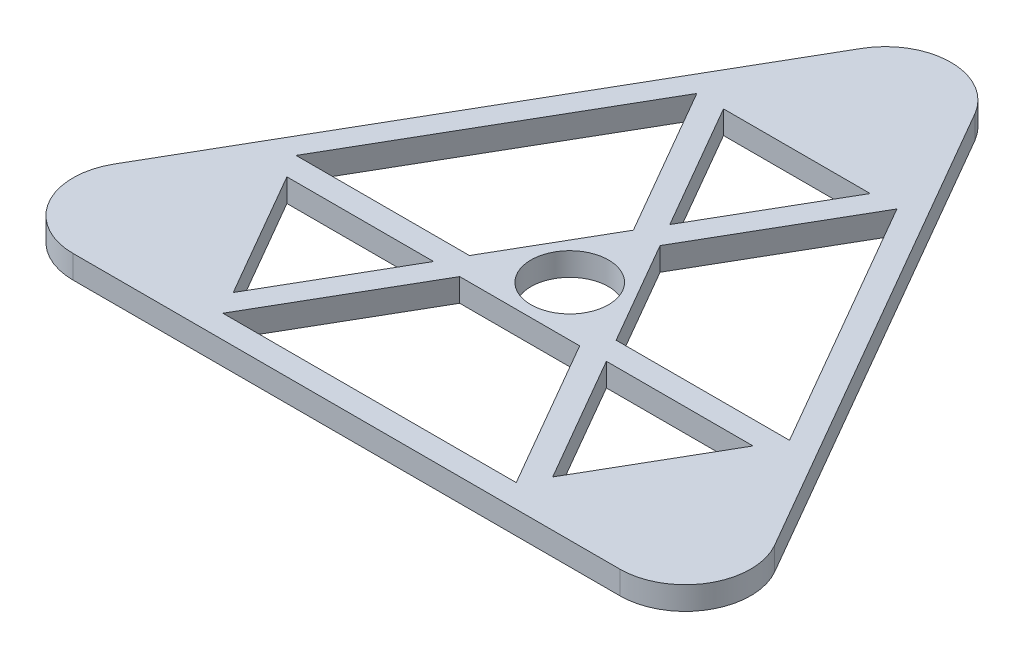
from build123d import *

# Parameters (mm, degrees)
EXTRUDE_17_DEPTH     = 2
SKETCH_4_R           = 3.35601343
CUT_EXTRUDE_25_DEPTH = 45.170960421


with BuildPart() as part:
    # 草图2 → 凸台-拉伸17 (new body)
    with BuildSketch(Plane(origin=(0, 0, 0), x_dir=(1, 0, 0), z_dir=(0, 1, 0))):
        with BuildLine():
            Line((-4.904700538, 30.145825623), (-28.559401011, -10.825317434))
            ThreePointArc((-28.559401011, -10.825317434), (-28.55940111, -16.488777843), (-23.654700538, -19.320508076))
            Line((-23.654700538, -19.320508076), (23.654700538, -19.320508076))
            ThreePointArc((23.654700538, -19.320508076), (28.559401192, -16.4887777), (28.559400847, -10.825317149))
            Line((28.559400847, -10.825317149), (4.904700538, 30.145825623))
            ThreePointArc((4.904700538, 30.145825623), (0, 32.977555799), (-4.904700538, 30.145825623))
        make_face()
        Polygon((-7.447524928, -4.330127019), (-13.79282439, -15.320508076), (-20.138123851, -4.330127019), align=None, mode=Mode.SUBTRACT)
        Polygon((5.190598923, -4.330127019), (12.690598923, -17.320508076), (-12.690598923, -17.320508076), (-5.190598923, -4.330127019), align=None, mode=Mode.SUBTRACT)
        Polygon((7.5, -4.330127019), (20.190598923, -4.330127019), (13.845299462, -15.320508076), align=None, mode=Mode.SUBTRACT)
        Polygon((-6.345299462, -2.330127019), (-21.345299462, -2.330127019), (-8.654700538, 19.650635095), (-1.154700538, 6.660254038), align=None, mode=Mode.SUBTRACT)
        Polygon((0, 8.660254038), (-6.345299462, 19.650635095), (6.345299462, 19.650635095), align=None, mode=Mode.SUBTRACT)
        Polygon((1.154700538, 6.660254038), (8.654700538, 19.650635095), (8.930688533, 19.172609866), (21.345299462, -2.330127019), (6.345299461, -2.330127019), align=None, mode=Mode.SUBTRACT)
    extrude(amount=EXTRUDE_17_DEPTH)

    # 草图4 → 切除-拉伸25 (cut, through all)
    with BuildSketch(Plane(origin=(0, 2, 0), x_dir=(1, 0, 0), z_dir=(0, 1, 0))):
        with Locations(Location((0, 0, 0), (0, 0, 270))):
            Circle(SKETCH_4_R)
    extrude(amount=-CUT_EXTRUDE_25_DEPTH, mode=Mode.SUBTRACT)


solid = part.part
